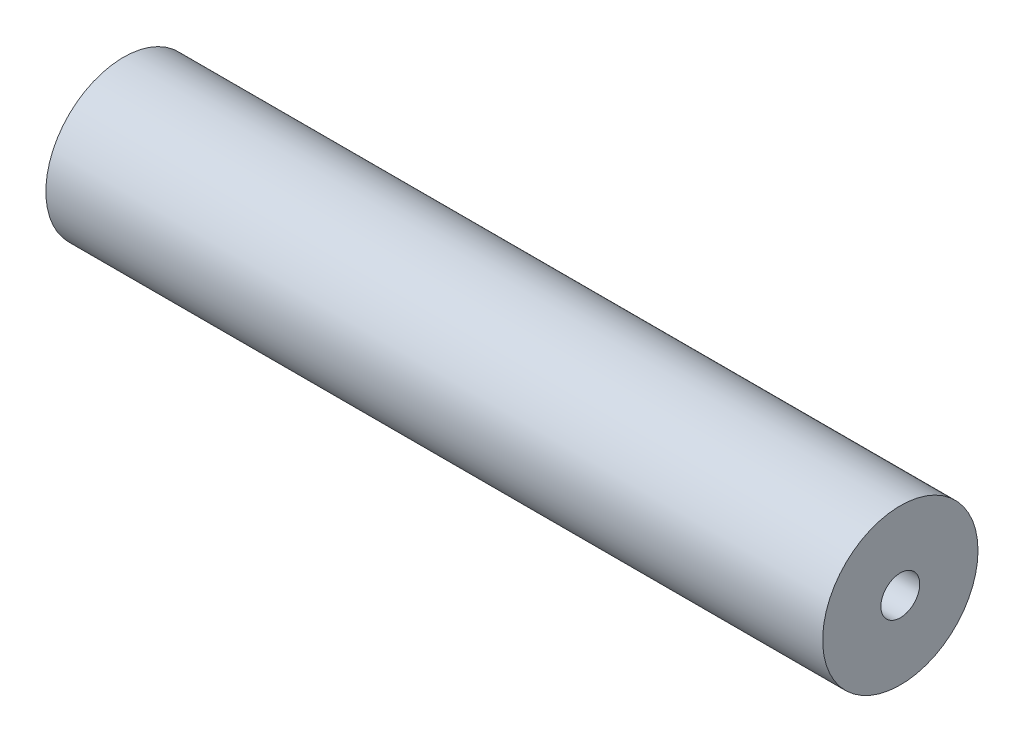
from build123d import *

# Parameters (mm, degrees)
SKETCH1_R           = 25.4
BOSS_EXTRUDE1_DEPTH = 254
SKETCH2_R           = 6.35
CUT_EXTRUDE1_DEPTH  = 257.527425434


with BuildPart() as part:
    # Sketch1 → Boss-Extrude1 (new body)
    with BuildSketch(Plane(origin=(0, 0, 0), x_dir=(0, 0, -1), z_dir=(1, 0, 0))):
        Circle(SKETCH1_R)
    extrude(amount=BOSS_EXTRUDE1_DEPTH)

    # Sketch2 → Cut-Extrude1 (cut, through all)
    with BuildSketch(Plane(origin=(254, 0, 0), x_dir=(0, 0, -1), z_dir=(1, 0, 0))):
        Circle(SKETCH2_R)
    extrude(amount=-CUT_EXTRUDE1_DEPTH, mode=Mode.SUBTRACT)


solid = part.part
